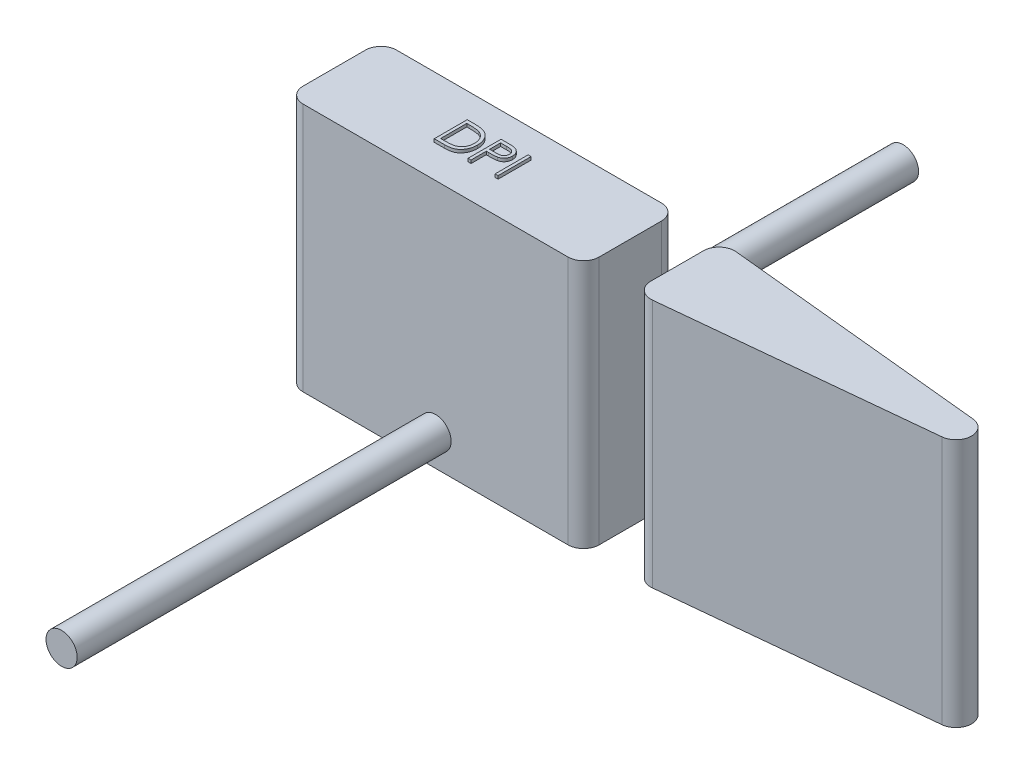
from build123d import *

# Parameters (mm, degrees)
SKETCH1_W             = 9.5
SKETCH1_H             = 3
BOSS_EXTRUDE1_DEPTH   = 8
BOSS_EXTRUDE1_2_DEPTH = 8
FILLET1_R             = 0.5
FILLET2_R             = 0.5
SKETCH3_W             = 0.094978632
SKETCH3_H             = 1.058333333
BOSS_EXTRUDE2_DEPTH   = 8.1
SKETCH4_R             = 0.5
BOSS_EXTRUDE3_DEPTH   = 12
BOSS_EXTRUDE4_START   = 12
SKETCH5_R             = 0.5
BOSS_EXTRUDE4_DEPTH   = 12


with BuildPart() as part:
    # Sketch1 → Boss-Extrude1 (new body)
    with BuildSketch(Plane(origin=(0, 0, 0), x_dir=(1, 0, 0), z_dir=(0, 1, 0))):
        Rectangle(SKETCH1_W, SKETCH1_H)
    extrude(amount=BOSS_EXTRUDE1_DEPTH)

    # Fillet1
    fillet1_edges = [part.edges().sort_by_distance(p)[0] for p in [
        (-4.75, 4, -1.5),
        (4.75, 4, -1.5),
        (4.75, 4, 1.5),
        (-4.75, 4, 1.5),
    ]]
    fillet(fillet1_edges, radius=FILLET1_R)

    # Sketch3 → Boss-Extrude2 (add)
    # profile 1 of 3: a face of its own
    with BuildSketch(Plane(origin=(0, 0, 0), x_dir=(1, 0, 0), z_dir=(0, 1, 0))):
        with BuildLine():
            Line((-1.082779152, -0.45910917), (-1.082779152, 0.599224163))
            Line((-1.082779152, 0.599224163), (-0.869077229, 0.599224163))
            add(Edge.make_bspline(
                [(-0.869077229, 0.599224163), (-0.850490178, 0.599090339), (-0.814580092, 0.59883179), (-0.762687756, 0.597192464), (-0.714674571, 0.59429249), (-0.670698445, 0.590068372), (-0.63063865, 0.584881621), (-0.594607356, 0.578380308), (-0.562418256, 0.570703409), (-0.542621544, 0.564158237), (-0.533259921, 0.561063106)],
                knots=[0, 0, 0, 0, 1.314313732, 2.53924729, 3.670748893, 4.714932338, 5.66265055, 6.526160246, 7.303039223, 8, 8, 8, 8], degree=3))
            add(Edge.make_bspline(
                [(-0.533259921, 0.561063106), (-0.521015083, 0.556397154), (-0.49680308, 0.547171059), (-0.462329498, 0.52976713), (-0.429876352, 0.51004793), (-0.399269611, 0.487987467), (-0.371208409, 0.462961105), (-0.344596497, 0.436031938), (-0.320522521, 0.406220702), (-0.298476441, 0.374145646), (-0.27859923, 0.340184621), (-0.261321437, 0.304402338), (-0.246972253, 0.266980516), (-0.235060492, 0.228023221), (-0.225672634, 0.187444792), (-0.219267622, 0.14519798), (-0.21504306, 0.101449749), (-0.214618502, 0.071763662), (-0.214403084, 0.056701126)],
                knots=[0, 0, 0, 0, 0.984719456, 1.947108742, 2.898477687, 3.838006223, 4.779231079, 5.722358779, 6.681677486, 7.655904652, 8.64651281, 9.637519902, 10.640069247, 11.656948941, 12.698408672, 13.768548281, 14.867775369, 16, 16, 16, 16], degree=3))
            add(Edge.make_bspline(
                [(-0.214403084, 0.056701126), (-0.214593271, 0.043619752), (-0.214968056, 0.017841537), (-0.21833335, -0.020149877), (-0.223224761, -0.057014218), (-0.230797649, -0.092575942), (-0.23999079, -0.127146617), (-0.251772807, -0.160357796), (-0.265269731, -0.192514138), (-0.281008623, -0.223180851), (-0.298287089, -0.252234633), (-0.316829616, -0.279622947), (-0.336616427, -0.304954979), (-0.357836201, -0.32830744), (-0.380214725, -0.349645127), (-0.403898511, -0.369146284), (-0.428948671, -0.386429337), (-0.455253009, -0.402173439), (-0.483578886, -0.415907689), (-0.514462827, -0.427528192), (-0.54803654, -0.437158002), (-0.584217617, -0.445192535), (-0.623068574, -0.45156591), (-0.664627499, -0.455837462), (-0.708830542, -0.458726087), (-0.739183319, -0.458978996), (-0.754806062, -0.45910917)],
                knots=[0, 0, 0, 0, 1.105936401, 2.179363191, 3.223086493, 4.248585256, 5.251745608, 6.245858792, 7.225916811, 8.198733463, 9.158002045, 10.082870192, 10.993790845, 11.873723703, 12.748670949, 13.606408763, 14.465103618, 15.319838547, 16.196477973, 17.123216899, 18.106603292, 19.147568657, 20.255746949, 21.433717677, 22.679120308, 24, 24, 24, 24], degree=3))
            Line((-0.754806062, -0.45910917), (-1.082779152, -0.45910917))
        make_face()
        with BuildLine():
            Line((-0.98780052, -0.350562162), (-0.866321153, -0.350562162))
            add(Edge.make_bspline(
                [(-0.866321153, -0.350562162), (-0.848865193, -0.350487142), (-0.81529099, -0.350342852), (-0.767013452, -0.349076721), (-0.722902301, -0.34700785), (-0.682951274, -0.344112529), (-0.647182926, -0.340281781), (-0.615522506, -0.336010679), (-0.588073797, -0.330689545), (-0.571464182, -0.325866279), (-0.563788767, -0.323637415)],
                knots=[0, 0, 0, 0, 1.375205317, 2.645023457, 3.804390687, 4.853969522, 5.800190428, 6.637939096, 7.370582563, 8, 8, 8, 8], degree=3))
            add(Edge.make_bspline(
                [(-0.563788767, -0.323637415), (-0.554128191, -0.320235158), (-0.535037782, -0.313511907), (-0.507557073, -0.301248043), (-0.481928169, -0.286721036), (-0.457704423, -0.270573206), (-0.435229458, -0.25223501), (-0.414236928, -0.232105211), (-0.394769097, -0.210081362), (-0.377027104, -0.186190799), (-0.361149593, -0.160582218), (-0.34739996, -0.13350738), (-0.335349616, -0.10526294), (-0.325891565, -0.075415171), (-0.318478519, -0.044230908), (-0.313227768, -0.011707958), (-0.309957602, 0.022147606), (-0.309576164, 0.045174558), (-0.309381716, 0.056913132)],
                knots=[0, 0, 0, 0, 0.998632004, 1.973411704, 2.929992603, 3.868527914, 4.809262121, 5.754881198, 6.702106254, 7.672490631, 8.653608572, 9.636854334, 10.631411391, 11.644891563, 12.686317036, 13.754757253, 14.855430412, 16, 16, 16, 16], degree=3))
            add(Edge.make_bspline(
                [(-0.309381716, 0.056913132), (-0.309536924, 0.069290637), (-0.309841833, 0.093606355), (-0.313674303, 0.129284493), (-0.319274868, 0.163598881), (-0.327373745, 0.196551811), (-0.337694272, 0.228207575), (-0.350574081, 0.258391093), (-0.365289939, 0.287421137), (-0.382798806, 0.314627671), (-0.401974473, 0.340358207), (-0.423255403, 0.363930288), (-0.446303496, 0.385397613), (-0.470867367, 0.4050945), (-0.497639299, 0.422228516), (-0.52598863, 0.437555203), (-0.556331249, 0.450562389), (-0.577441279, 0.457480522), (-0.588169443, 0.460996332)],
                knots=[0, 0, 0, 0, 1.122418816, 2.205001699, 3.251619955, 4.274784885, 5.280384055, 6.268708349, 7.249350384, 8.229342522, 9.199999885, 10.157847722, 11.105861043, 12.055065948, 13.010012805, 13.98527497, 14.976112212, 16, 16, 16, 16], degree=3))
            add(Edge.make_bspline(
                [(-0.588169443, 0.460996332), (-0.597044671, 0.463450585), (-0.61591584, 0.468669001), (-0.646710154, 0.474361435), (-0.681367592, 0.479382319), (-0.720042025, 0.483633203), (-0.762689369, 0.486683416), (-0.809342422, 0.488972838), (-0.86002135, 0.490516986), (-0.895152735, 0.490622428), (-0.913386457, 0.490677155)],
                knots=[0, 0, 0, 0, 0.674548936, 1.434276114, 2.292660221, 3.240891867, 4.284742987, 5.42552168, 6.663806718, 8, 8, 8, 8], degree=3))
            Line((-0.913386457, 0.490677155), (-0.98780052, 0.490677155))
            Line((-0.98780052, 0.490677155), (-0.98780052, -0.350562162))
        make_face(mode=Mode.SUBTRACT)
    # profile 2 of 3: a face of its own
    with BuildSketch(Plane(origin=(0, 0, 0), x_dir=(1, 0, 0), z_dir=(0, 1, 0))):
        with BuildLine():
            Line((0.002690933, 0.599224163), (0.210244686, 0.599224163))
            add(Edge.make_bspline(
                [(0.210244686, 0.599224163), (0.224520365, 0.599208471), (0.251873199, 0.599178403), (0.291096561, 0.598266802), (0.32671998, 0.597049207), (0.358666643, 0.595361349), (0.387034844, 0.593366665), (0.411696218, 0.590569025), (0.432844608, 0.587647935), (0.44551632, 0.584678129), (0.451295367, 0.583323723)],
                knots=[0, 0, 0, 0, 1.415646017, 2.712440637, 3.8905458, 4.950247383, 5.884950622, 6.709939814, 7.411656543, 8, 8, 8, 8], degree=3))
            add(Edge.make_bspline(
                [(0.451295367, 0.583323723), (0.458611031, 0.581321371), (0.473069974, 0.577363851), (0.493904337, 0.56943732), (0.513726571, 0.560038666), (0.532604685, 0.549327141), (0.550306696, 0.536843173), (0.567096713, 0.523092817), (0.582826565, 0.507758604), (0.597407795, 0.491012524), (0.610798674, 0.473135698), (0.622328364, 0.453861262), (0.631982549, 0.433513654), (0.640262729, 0.412107026), (0.64622219, 0.389461619), (0.65071161, 0.36573478), (0.653561135, 0.340929052), (0.653834053, 0.323977616), (0.653972985, 0.315348295)],
                knots=[0, 0, 0, 0, 0.999701418, 1.975846123, 2.934577507, 3.890451536, 4.834027766, 5.787354733, 6.749476667, 7.726910423, 8.712836071, 9.690891519, 10.682875813, 11.679750201, 12.712814741, 13.765529915, 14.8625177, 16, 16, 16, 16], degree=3))
            add(Edge.make_bspline(
                [(0.653972985, 0.315348295), (0.653845554, 0.306646444), (0.653596227, 0.289620683), (0.650603779, 0.264712721), (0.646572983, 0.240909779), (0.640375064, 0.218264636), (0.632257444, 0.196911772), (0.622734847, 0.176524876), (0.611249351, 0.157450785), (0.598051986, 0.139620251), (0.583370909, 0.12301654), (0.567268235, 0.107759971), (0.549808972, 0.09393985), (0.531048608, 0.081525193), (0.510804249, 0.07080389), (0.489382932, 0.061201086), (0.466598461, 0.053136265), (0.450831558, 0.048893842), (0.442815132, 0.04673685)],
                knots=[0, 0, 0, 0, 1.121902311, 2.195077645, 3.232258892, 4.234102512, 5.217864754, 6.176164875, 7.132989551, 8.084763148, 9.034132444, 9.988522005, 10.94243251, 11.903244335, 12.886203696, 13.894208494, 14.929344452, 16, 16, 16, 16], degree=3))
            add(Edge.make_bspline(
                [(0.442815132, 0.04673685), (0.436184724, 0.045326854), (0.421653799, 0.042236764), (0.397722547, 0.038787064), (0.369859538, 0.035842599), (0.338102801, 0.033634874), (0.302480841, 0.031744882), (0.26297439, 0.030242625), (0.219505895, 0.029417169), (0.189185781, 0.029374596), (0.173355664, 0.029352368)],
                knots=[0, 0, 0, 0, 0.601384939, 1.31797006, 2.144135048, 3.087295005, 4.142315834, 5.309527816, 6.595305764, 8, 8, 8, 8], degree=3))
            Line((0.173355664, 0.029352368), (0.097669566, 0.029352368))
            Line((0.097669566, 0.029352368), (0.097669566, -0.45910917))
            Line((0.097669566, -0.45910917), (0.002690933, -0.45910917))
            Line((0.002690933, -0.45910917), (0.002690933, 0.599224163))
        make_face()
        with BuildLine():
            Line((0.097669566, 0.490677155), (0.097669566, 0.137899377))
            Line((0.097669566, 0.137899377), (0.282962702, 0.135567312))
            add(Edge.make_bspline(
                [(0.282962702, 0.135567312), (0.292009917, 0.135562636), (0.309475381, 0.13555361), (0.334704905, 0.136758665), (0.358111999, 0.138149779), (0.379624764, 0.140186594), (0.399252896, 0.143065641), (0.417029125, 0.145972047), (0.432815613, 0.150176764), (0.451290848, 0.155838263), (0.471877955, 0.165494078), (0.494274571, 0.179509402), (0.513255201, 0.197374283), (0.529680019, 0.217460794), (0.542714416, 0.239806483), (0.552256347, 0.263715423), (0.55786284, 0.288942416), (0.558614617, 0.306204782), (0.558994352, 0.314924283)],
                knots=[0, 0, 0, 0, 1.160613943, 2.240541288, 3.23993089, 4.169200891, 5.011653406, 5.7853311, 6.478053781, 7.106038997, 8.262395093, 9.384106736, 10.481365981, 11.59014053, 12.70357646, 13.786202915, 14.881775077, 16, 16, 16, 16], degree=3))
            add(Edge.make_bspline(
                [(0.558994352, 0.314924283), (0.558612552, 0.323432834), (0.55785358, 0.340346779), (0.552212403, 0.365135595), (0.542732967, 0.388792582), (0.529592521, 0.410858253), (0.513644608, 0.430872486), (0.495108854, 0.448258522), (0.474028892, 0.462235085), (0.454420022, 0.471256101), (0.43700252, 0.476764053), (0.421873809, 0.48061785), (0.404792105, 0.48369476), (0.385751847, 0.486186229), (0.364900614, 0.488319061), (0.342059267, 0.489766249), (0.317314332, 0.490613356), (0.300135897, 0.490655374), (0.291230931, 0.490677155)],
                knots=[0, 0, 0, 0, 1.120700087, 2.227813068, 3.331159281, 4.466773991, 5.599788987, 6.693661531, 7.80175334, 8.91857717, 9.525282508, 10.207424825, 10.974604443, 11.810962634, 12.737642355, 13.736264703, 14.826523623, 16, 16, 16, 16], degree=3))
            Line((0.291230931, 0.490677155), (0.097669566, 0.490677155))
        make_face(mode=Mode.SUBTRACT)
    # profile 3 of 3: a face of its own
    with BuildSketch(Plane(origin=(0, 0, 0), x_dir=(1, 0, 0), z_dir=(0, 1, 0))):
        with Locations((0.918556318, 0.070057497)):
            Rectangle(SKETCH3_W, SKETCH3_H)
    extrude(amount=BOSS_EXTRUDE2_DEPTH)

    # Sketch4 → Boss-Extrude3 (add)
    with BuildSketch(Plane.XY.offset(1.5)):
        with Locations(Location((0, 1, 0), (0, 0, 180))):
            Circle(SKETCH4_R)
    extrude(amount=BOSS_EXTRUDE3_DEPTH)

    # Sketch5 → Boss-Extrude4 (add)
    with BuildSketch(Plane(origin=(0, 0, -1.5), x_dir=(-1, 0, 0), z_dir=(0, 0, -1)).offset(BOSS_EXTRUDE4_START)):
        with Locations((0, 1)):
            Circle(SKETCH5_R)
    extrude(amount=-BOSS_EXTRUDE4_DEPTH)


with BuildPart() as body_2:
    # Sketch1 → Boss-Extrude1 2 (new body)
    with BuildSketch(Plane(origin=(0, 0, 0), x_dir=(1, 0, 0), z_dir=(0, 1, 0))):
        Polygon((6.25, 1.397506219), (20.225062189, 0), (6.25, -1.397506219), align=None)
    extrude(amount=BOSS_EXTRUDE1_2_DEPTH)

    # Fillet2
    fillet2_edges = [body_2.edges().sort_by_distance(p)[0] for p in [
        (6.25, 4, -1.397506219),
        (20.225062189, 4, 0),
        (6.25, 4, 1.397506219),
    ]]
    fillet(fillet2_edges, radius=FILLET2_R)


solid = Compound([part.part, body_2.part])
